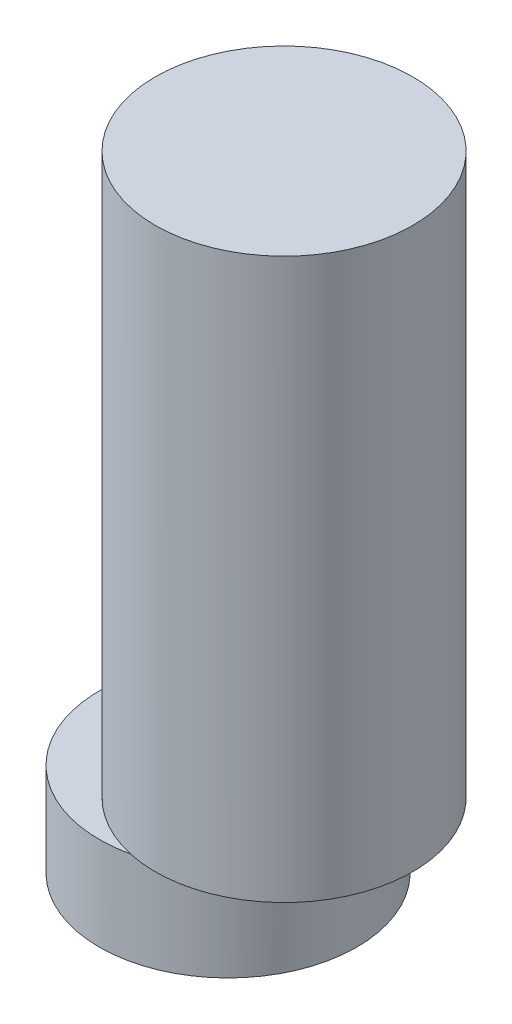
from build123d import *

# Parameters (mm, degrees)
SKETCH1_R           = 3.45
BOSS_EXTRUDE1_DEPTH = 2.5
SKETCH2_R           = 3.45
BOSS_EXTRUDE2_DEPTH = 15


with BuildPart() as part:
    # Sketch1 → Boss-Extrude1 (new body)
    with BuildSketch(Plane(origin=(0, 0, 0), x_dir=(1, 0, 0), z_dir=(0, 1, 0))):
        with Locations(Location((0, 0, 0), (0, 0, 270))):
            Circle(SKETCH1_R)
    extrude(amount=BOSS_EXTRUDE1_DEPTH)

    # Sketch2 → Boss-Extrude2 (add)
    with BuildSketch(Plane(origin=(0, 2.5, 0), x_dir=(1, 0, 0), z_dir=(0, 1, 0))):
        with Locations(Location((1.5, 0, 0), (0, 0, 102.555857799))):
            Circle(SKETCH2_R)
    extrude(amount=BOSS_EXTRUDE2_DEPTH)


solid = part.part
